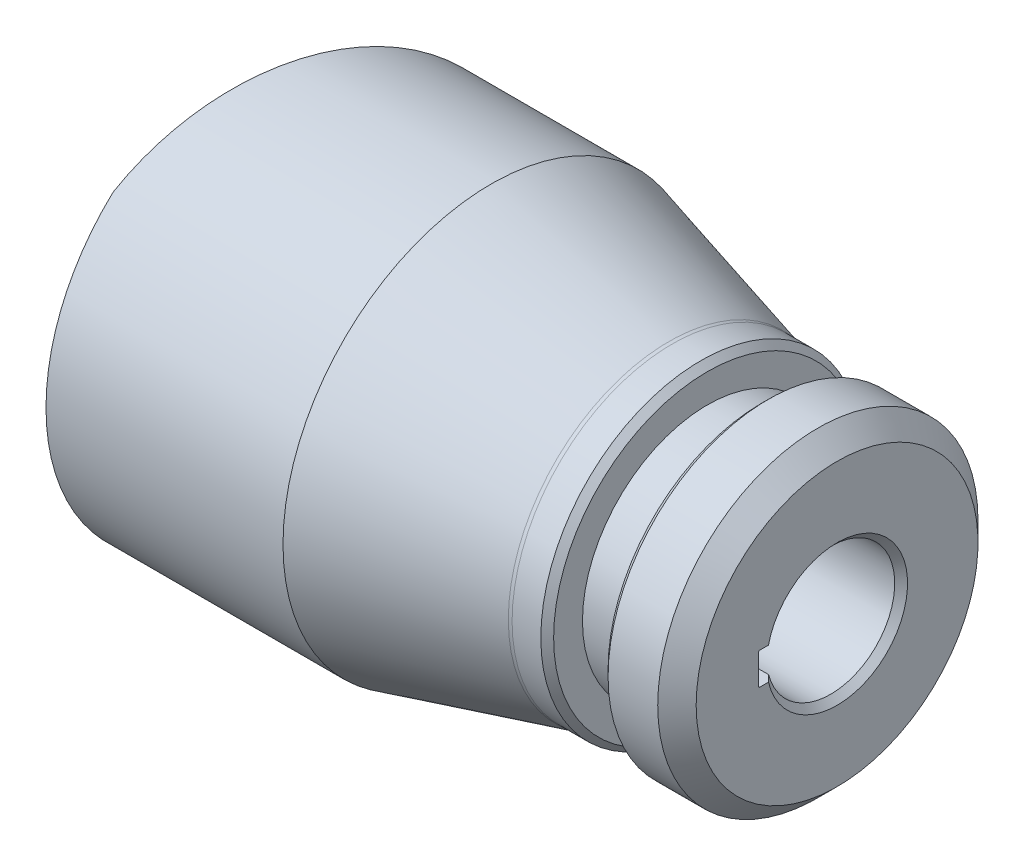
from build123d import *

# Parameters (mm, degrees)
CUT_EXTRUDE_12_DEPTH      = 102.948516419
CUT_EXTRUDE_12_DEPTH_BACK = 102.948516419
CUT_EXTRUDE_START         = 61
CUT_EXTRUDE_5_R0_25_DEPTH = 31


with BuildPart() as part:
    # Эскиз1 → Revolve 238 (revolve)
    with BuildSketch(Plane.XY, mode=Mode.PRIVATE) as revolve_238_sk:
        with BuildLine():
            Line((0, 32.5), (37, 32.5))
            Line((37, 32.5), (64.745695, 25.068113))
            ThreePointArc((64.745695, 25.068113), (65.002224223, 25.017098236), (65.263217049, 24.999995817))
            Line((65.263217049, 24.999995817), (69.749999449, 24.999995817))
            Line((69.749999449, 24.999995817), (70.749999449, 23.999995817))
            Line((70.749999449, 23.999995817), (70.749999449, 19.499995817))
            Line((70.749999449, 19.499995817), (79.25, 19.499995817))
            Line((79.25, 19.499995817), (79.25, 24))
            Line((79.25, 24), (80.25, 25))
            Line((80.25, 25), (88, 25))
            Line((88, 25), (91, 22))
            Line((91, 22), (91, 11))
            Line((91, 11), (90, 10))
            Line((90, 10), (61, 10))
            Line((61, 10), (61, 19))
            ThreePointArc((61, 19), (60.707106781, 19.707106781), (60, 20))
            Line((60, 20), (25, 20))
            Line((25, 20), (25, 27.1))
            ThreePointArc((25, 27.1), (24.882842712, 27.382842712), (24.6, 27.5))
            Line((24.6, 27.5), (0, 27.5))
            Line((0, 27.5), (0, 32.5))
        make_face()
    revolve(revolve_238_sk.sketch.rotate(Axis((0, 0, 0), (1, 0, 0)), 90), axis=Axis((0, 0, 0), (1, 0, 0)))

    # Эскиз2 → Наклон торца 12 градусов (cut, two sides: drawn at the far end of the back side and taken through both)
    with BuildSketch(Plane(origin=(0, 0, 0), x_dir=(1, 0, 0), z_dir=(0, 1, 0)).offset(-CUT_EXTRUDE_12_DEPTH_BACK)):
        Polygon((-25, 50), (15.30407244, 50), (-5.951583727, -50), (-25, -50), align=None)
    extrude(amount=CUT_EXTRUDE_12_DEPTH + CUT_EXTRUDE_12_DEPTH_BACK, mode=Mode.SUBTRACT)

    # Эскиз3 → Паз 5 R0.25 (cut)
    with BuildSketch(Plane(origin=(0, 0, 0), x_dir=(0, 0, -1), z_dir=(1, 0, 0)).offset(CUT_EXTRUDE_START)):
        with BuildLine():
            Line((0, -2.5), (0, 2.5))
            Line((0, 2.5), (-12.05, 2.5))
            ThreePointArc((-12.05, 2.5), (-12.226776695, 2.426776695), (-12.3, 2.25))
            Line((-12.3, 2.25), (-12.3, -2.25))
            ThreePointArc((-12.3, -2.25), (-12.226776695, -2.426776695), (-12.05, -2.5))
            Line((-12.05, -2.5), (0, -2.5))
        make_face()
    extrude(amount=CUT_EXTRUDE_5_R0_25_DEPTH, mode=Mode.SUBTRACT)


solid = part.part
